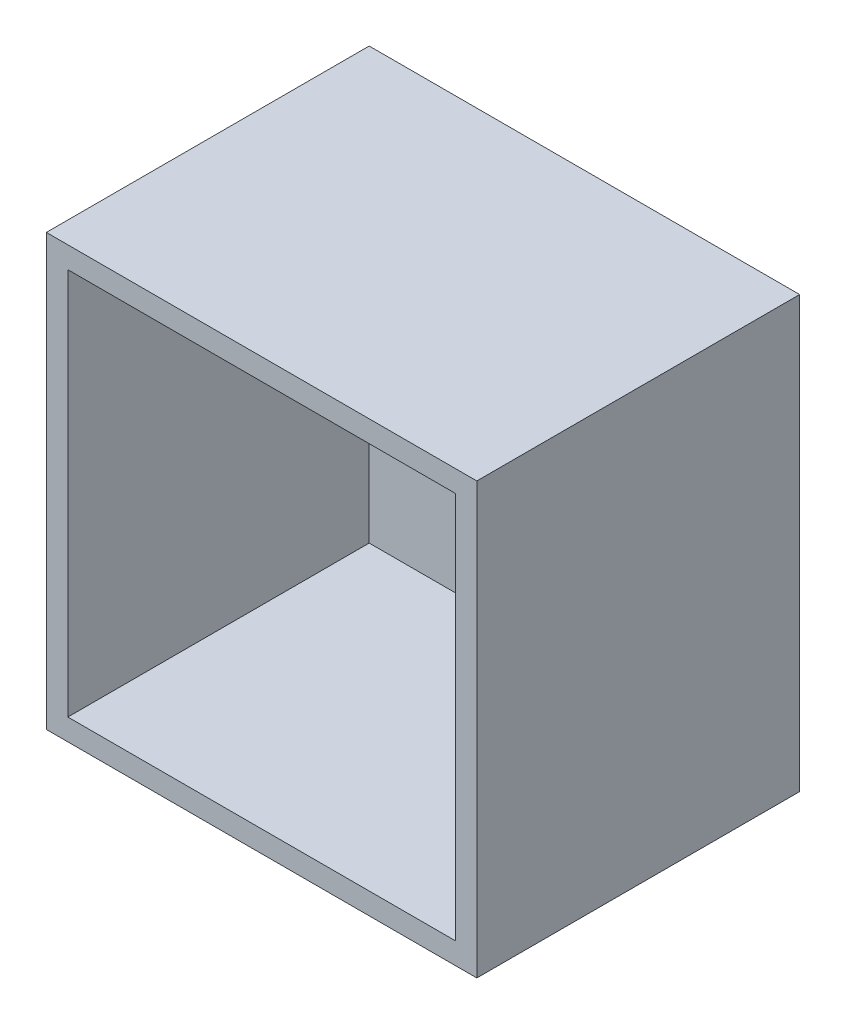
from build123d import *

# Parameters (mm, degrees)
SKETCH1_W           = 1800
SKETCH1_H           = 1800
BOSS_EXTRUDE1_DEPTH = 100
SKETCH1_4_W         = 2000
SKETCH1_4_H         = 2000
SKETCH1_4_W_2       = 1800
SKETCH1_4_H_2       = 1800
BOSS_EXTRUDE2_DEPTH = 1500


with BuildPart() as part:
    # Sketch1 → Boss-Extrude1 (new body)
    with BuildSketch(Plane.XY):
        Rectangle(SKETCH1_W, SKETCH1_H)
    extrude(amount=BOSS_EXTRUDE1_DEPTH)

    # Sketch1<4> → Boss-Extrude2 (add)
    with BuildSketch(Plane.XY):
        Rectangle(SKETCH1_4_W, SKETCH1_4_H)
        Rectangle(SKETCH1_4_W_2, SKETCH1_4_H_2, mode=Mode.SUBTRACT)
    extrude(amount=BOSS_EXTRUDE2_DEPTH)


solid = part.part
